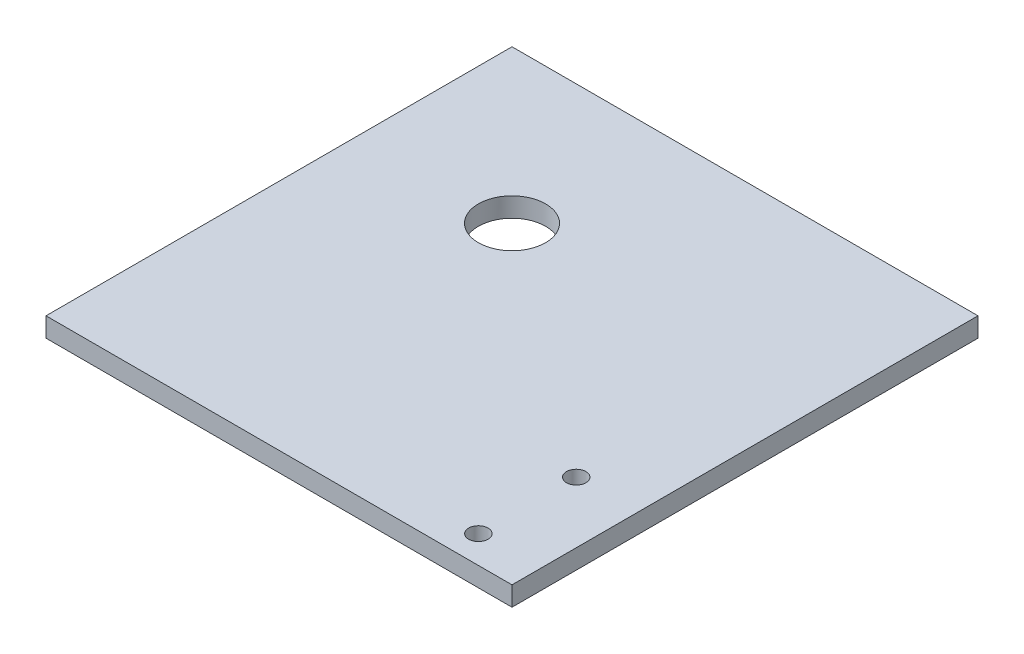
from build123d import *

# Parameters (mm, degrees)
SKETCH3_W           = 152.4
SKETCH3_H           = 152.4
BOSS_EXTRUDE1_DEPTH = 3.175
SKETCH4_R           = 11
CUT_EXTRUDE1_DEPTH  = 10
SKETCH5_R           = 3.175
CUT_EXTRUDE5_DEPTH  = 10


with BuildPart() as part:
    # Sketch3 → Boss-Extrude1 (new, symmetric)
    with BuildSketch(Plane(origin=(0, 0, 0), x_dir=(1, 0, 0), z_dir=(0, 1, 0))):
        Rectangle(SKETCH3_W, SKETCH3_H)
    extrude(amount=BOSS_EXTRUDE1_DEPTH, both=True)

    # Sketch4 → Cut-Extrude1 (cut)
    with BuildSketch(Plane(origin=(0, 3.175, 0), x_dir=(1, 0, 0), z_dir=(0, 1, 0))):
        with Locations(Location((-26.2, 26.2, 0), (0, 0, 270))):
            Circle(SKETCH4_R)
    extrude(amount=-CUT_EXTRUDE1_DEPTH, mode=Mode.SUBTRACT)

    # Sketch5 → Cut-Extrude5 (cut)
    with BuildSketch(Plane(origin=(0, 3.175, 0), x_dir=(1, 0, 0), z_dir=(0, 1, 0))):
        with Locations(Location((56.2, -35.2, 0), (0, 0, 270))):
            Circle(SKETCH5_R)
        with Locations(Location((56.2, -67.2, 0), (0, 0, 270))):
            Circle(SKETCH5_R)
    extrude(amount=-CUT_EXTRUDE5_DEPTH, mode=Mode.SUBTRACT)


solid = part.part
